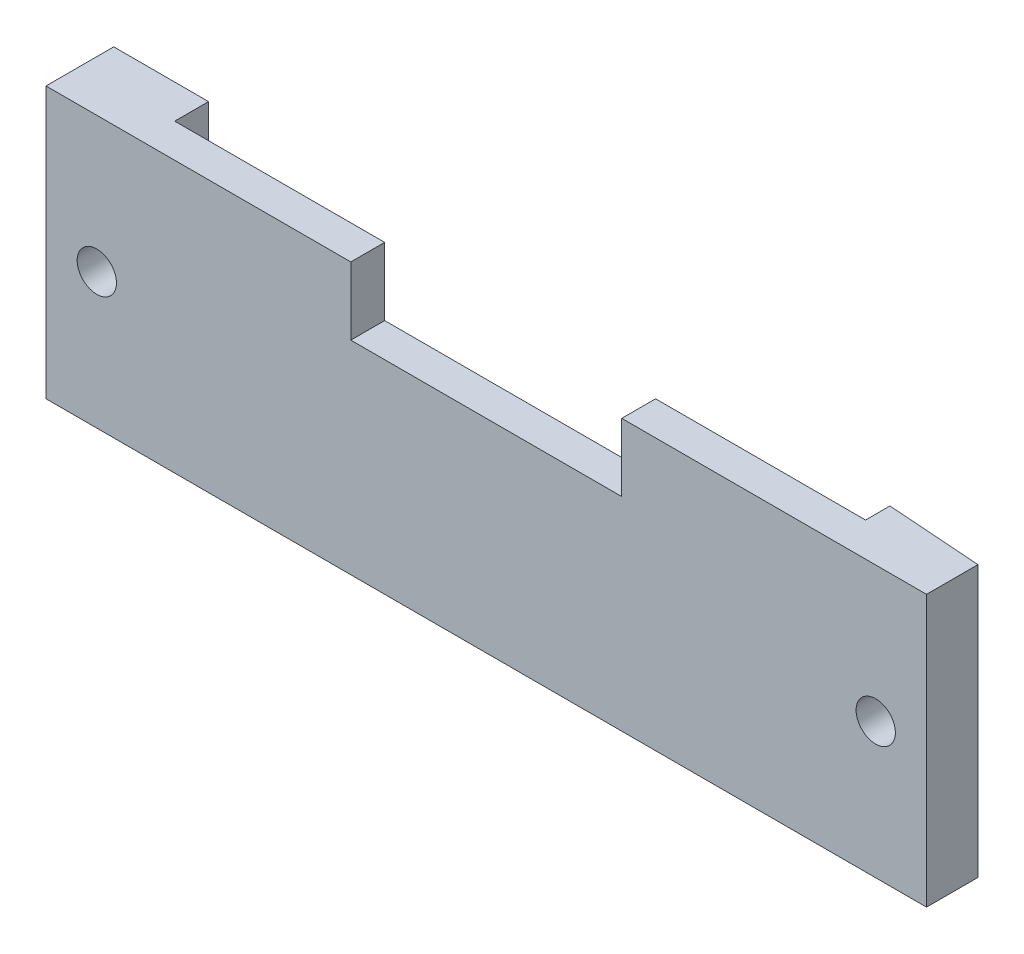
from build123d import *

# Parameters (mm, degrees)
BOSS_EXTRUDE1_DEPTH     = 5
CUT_EXTRUDE1_REACH      = 40.487
SKETCH2_W               = 51
SKETCH2_H               = 2.5
M3_5X0_6_TAPPED_HOLE4_D = 2.9
CUT_EXTRUDE2_REACH      = 40.487
CUT_EXTRUDE3_REACH      = 40.487


with BuildPart() as part:
    # Sketch1 → Boss-Extrude1 (new body)
    with BuildSketch(Plane.XY):
        Polygon((0, 0), (32.5, 0), (32.5, 20), (-32.5, 20), (-32.5, 0), align=None)
    extrude(amount=BOSS_EXTRUDE1_DEPTH)

    # Sketch2 → Cut-Extrude1 (cut, up to next)
    with BuildSketch(Plane.XZ, mode=Mode.PRIVATE) as cut_extrude1_sk1:
        with Locations((0, 1.25)):
            Rectangle(SKETCH2_W, SKETCH2_H)
    cut_extrude1_tool1 = extrude(cut_extrude1_sk1.sketch, amount=-CUT_EXTRUDE1_REACH, mode=Mode.PRIVATE) & part.part
    add(cut_extrude1_tool1.solids().sort_by_distance((0, 0, 1.25))[0], mode=Mode.SUBTRACT)

    # M3.5x0.6 Tapped Hole4 (through all)
    with Locations(Plane.XY.offset(5)):
        with Locations((-28.75, 10), (28.75, 10)):
            Hole(M3_5X0_6_TAPPED_HOLE4_D / 2)

    # Sketch12 → Cut-Extrude2 (cut, up to next)
    with BuildSketch(Plane.XY.offset(5), mode=Mode.PRIVATE) as cut_extrude2_sk1:
        Polygon((0, 20), (-10, 20), (-10, 15), (10, 15), (10, 20), align=None)
    cut_extrude2_tool1 = extrude(cut_extrude2_sk1.sketch, amount=-CUT_EXTRUDE2_REACH, mode=Mode.PRIVATE) & part.part
    add(cut_extrude2_tool1.solids().sort_by_distance((0, 17.5, 5))[0], mode=Mode.SUBTRACT)

    # Sketch13 → Cut-Extrude3 (cut, up to next)
    with BuildSketch(Plane.XZ, mode=Mode.PRIVATE) as cut_extrude3_sk1:
        Polygon((25.5, 0), (25.5, 0.7), (32.5, 1.2), (32.5, 0), align=None)
    cut_extrude3_tool1 = extrude(cut_extrude3_sk1.sketch, amount=-CUT_EXTRUDE3_REACH, mode=Mode.PRIVATE) & part.part
    add(cut_extrude3_tool1.solids().sort_by_distance((29.307018, 0, 0.485965))[0], mode=Mode.SUBTRACT)


solid = part.part
